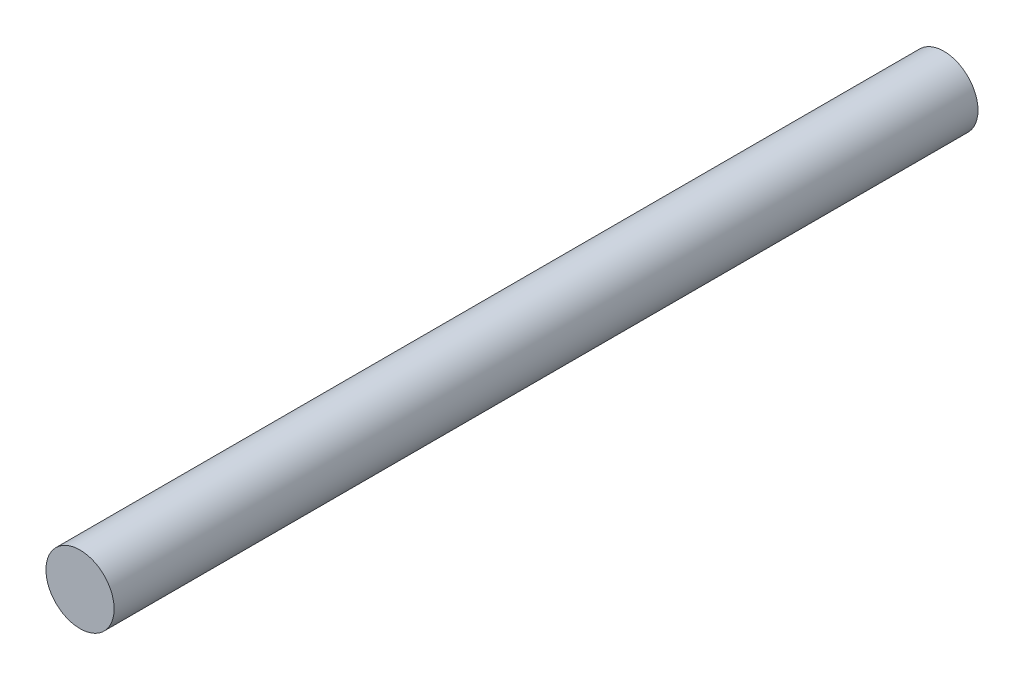
from build123d import *

# Parameters (mm, degrees)
SKETCH_1_R      = 1.5
EXTRUDE_1_DEPTH = 19


with BuildPart() as part:
    # 草圖1 → 伸長1 (new, symmetric)
    with BuildSketch(Plane.XY):
        Circle(SKETCH_1_R)
    extrude(amount=EXTRUDE_1_DEPTH, both=True)


solid = part.part
